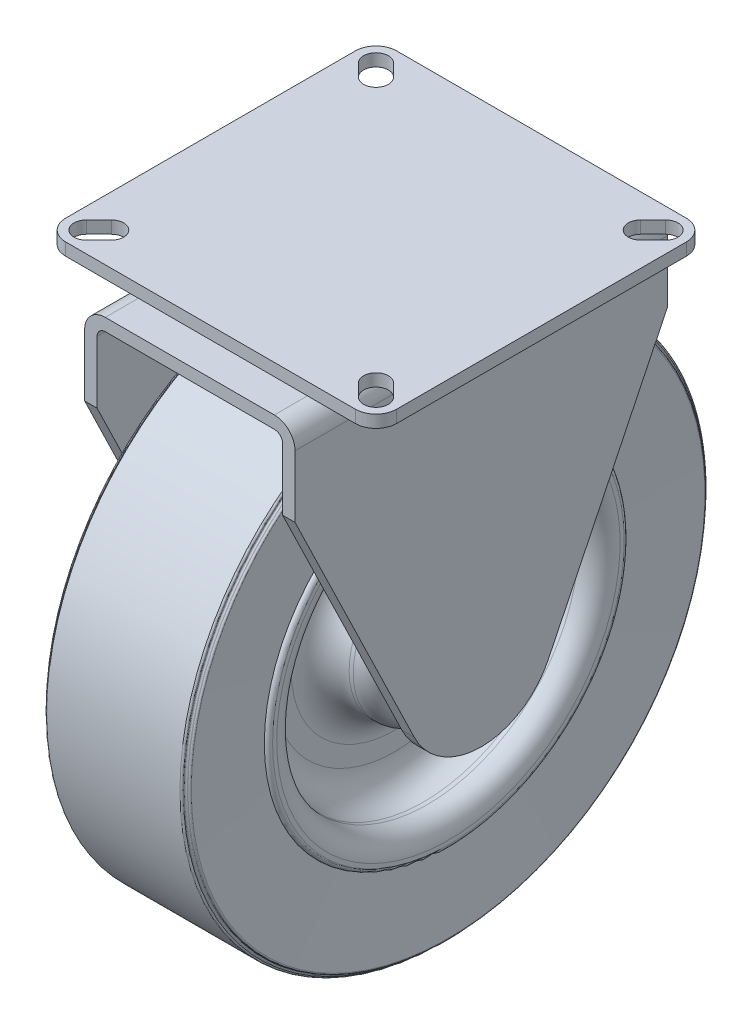
from build123d import *

# Parameters (mm, degrees)
BOSS_EXTRUDE2_START = -45
BOSS_EXTRUDE2_DEPTH = 90
CUT_EXTRUDE1_DEPTH  = 3
CUT_EXTRUDE2_START  = -47
CUT_EXTRUDE2_DEPTH  = 62.30990914
BOSS_EXTRUDE3_REACH = 110.31
SKETCH7_R           = 10
SKETCH8_R           = 20
SKETCH8_R_2         = 18
BOSS_EXTRUDE4_DEPTH = 3
BOSS_EXTRUDE5_DEPTH = 3
CUT_EXTRUDE3_DEPTH  = 3


with BuildPart() as part:
    # Sketch1 → Revolve1 (revolve)
    with BuildSketch(Plane.XY):
        with BuildLine():
            ThreePointArc((-17.5, 11), (-17.207106781, 10.292893219), (-16.5, 10))
            Line((-16.5, 10), (16.5, 10))
            ThreePointArc((16.5, 10), (17.207106781, 10.292893219), (17.5, 11))
            Line((17.5, 11), (17.5, 13))
            ThreePointArc((17.5, 13), (16.035533906, 16.535533906), (12.5, 18))
            Line((12.5, 18), (11.5, 18))
            ThreePointArc((11.5, 18), (6.550252532, 20.050252532), (4.5, 25))
            Line((4.5, 25), (4.5, 29.5))
            ThreePointArc((4.5, 29.5), (6.550252532, 34.449747468), (11.5, 36.5))
            Line((11.5, 36.5), (12.5, 36.5))
            ThreePointArc((12.5, 36.5), (16.035533906, 37.964466094), (17.5, 41.5))
            Line((17.5, 41.5), (17.5, 42.5))
            ThreePointArc((17.5, 42.5), (17.207106781, 43.207106781), (16.5, 43.5))
            Line((16.5, 43.5), (-16.5, 43.5))
            ThreePointArc((-16.5, 43.5), (-17.207106781, 43.207106781), (-17.5, 42.5))
            Line((-17.5, 42.5), (-17.5, 41.5))
            ThreePointArc((-17.5, 41.5), (-16.035533906, 37.964466094), (-12.5, 36.5))
            Line((-12.5, 36.5), (-11.5, 36.5))
            ThreePointArc((-11.5, 36.5), (-6.550252532, 34.449747468), (-4.5, 29.5))
            Line((-4.5, 29.5), (-4.5, 25))
            ThreePointArc((-4.5, 25), (-6.550252532, 20.050252532), (-11.5, 18))
            Line((-11.5, 18), (-12.5, 18))
            ThreePointArc((-12.5, 18), (-16.035533906, 16.535533906), (-17.5, 13))
            Line((-17.5, 13), (-17.5, 11))
        make_face()
    revolve(axis=Axis((-25.77893442, 0, 0), (1, 0, 0)))

    # Sketch2 → Revolve3 (revolve)
    with BuildSketch(Plane.XY):
        with BuildLine():
            Line((-17.429001248, 62.080024953), (-16.5, 43.5))
            Line((-16.5, 43.5), (16.5, 43.5))
            Line((16.5, 43.5), (17.429001248, 62.080024953))
            ThreePointArc((17.429001248, 62.080024953), (17.319319237, 62.375690026), (17.029500312, 62.5))
            Line((17.029500312, 62.5), (16.9, 62.5))
            ThreePointArc((16.9, 62.5), (16.617157288, 62.617157288), (16.5, 62.9))
            Line((16.5, 62.9), (16.5, 63.1))
            ThreePointArc((16.5, 63.1), (16.382842712, 63.382842712), (16.1, 63.5))
            Line((16.1, 63.5), (-16.1, 63.5))
            ThreePointArc((-16.1, 63.5), (-16.382842712, 63.382842712), (-16.5, 63.1))
            Line((-16.5, 63.1), (-16.5, 62.9))
            ThreePointArc((-16.5, 62.9), (-16.617157288, 62.617157288), (-16.9, 62.5))
            Line((-16.9, 62.5), (-17.029500312, 62.5))
            ThreePointArc((-17.029500312, 62.5), (-17.319319237, 62.375690026), (-17.429001248, 62.080024953))
        make_face()
    revolve(axis=Axis((-24.991695295, 0, 0), (1, 0, 0)))


with BuildPart() as body_2:
    # Sketch5 → Boss-Extrude2 (new body)
    with BuildSketch(Plane.XY.offset(BOSS_EXTRUDE2_START)):
        with BuildLine():
            Line((22.429001248, -18), (25.429001248, -18))
            Line((25.429001248, -18), (25.429001248, 66.5))
            ThreePointArc((25.429001248, 66.5), (23.964535154, 70.035533906), (20.429001248, 71.5))
            Line((20.429001248, 71.5), (-20.429001248, 71.5))
            ThreePointArc((-20.429001248, 71.5), (-23.964535154, 70.035533906), (-25.429001248, 66.5))
            Line((-25.429001248, 66.5), (-25.429001248, -18))
            Line((-25.429001248, -18), (-22.429001248, -18))
            Line((-22.429001248, -18), (-22.429001248, -15))
            Line((-22.429001248, -15), (-22.429001248, 66.5))
            ThreePointArc((-22.429001248, 66.5), (-21.84321481, 67.914213562), (-20.429001248, 68.5))
            Line((-20.429001248, 68.5), (20.429001248, 68.5))
            ThreePointArc((20.429001248, 68.5), (21.84321481, 67.914213562), (22.429001248, 66.5))
            Line((22.429001248, 66.5), (22.429001248, -15))
            Line((22.429001248, -15), (22.429001248, -18))
        make_face()
    extrude(amount=BOSS_EXTRUDE2_DEPTH)

    # Sketch6 → Cut-Extrude1 (cut)
    with BuildSketch(Plane.ZY.offset(25.429001248)):
        with BuildLine():
            ThreePointArc((16.193849901, -7.858703797), (9.553620523, -15.255436241), (-8.9e-08, -18))
            Line((-8.9e-08, -18), (45, -18))
            Line((45, -18), (45, 51.5))
            Line((45, 51.5), (16.193849901, -7.858703797))
        make_face()
        with BuildLine():
            Line((-16.193849901, -7.858703797), (-45, 51.5))
            Line((-45, 51.5), (-45, -18))
            Line((-45, -18), (-8.9e-08, -18))
            ThreePointArc((-8.9e-08, -18), (-9.553620599, -15.255436194), (-16.193849901, -7.858703797))
        make_face()
    extrude(amount=-CUT_EXTRUDE1_DEPTH, mode=Mode.SUBTRACT)

    # Sketch6<3> → Cut-Extrude2 (cut, through all)
    with BuildSketch(Plane.ZY.offset(25.429001248).offset(CUT_EXTRUDE2_START)):
        with BuildLine():
            ThreePointArc((16.193849901, -7.858703797), (9.553620523, -15.255436241), (-8.9e-08, -18))
            Line((-8.9e-08, -18), (45, -18))
            Line((45, -18), (45, 51.5))
            Line((45, 51.5), (16.193849901, -7.858703797))
        make_face()
        with BuildLine():
            Line((-16.193849901, -7.858703797), (-45, 51.5))
            Line((-45, 51.5), (-45, -18))
            Line((-45, -18), (-8.9e-08, -18))
            ThreePointArc((-8.9e-08, -18), (-9.553620599, -15.255436194), (-16.193849901, -7.858703797))
        make_face()
    extrude(amount=-CUT_EXTRUDE2_DEPTH, mode=Mode.SUBTRACT)

    # Sketch7 → Boss-Extrude3 (add, up to next)
    with BuildSketch(Plane.ZY.offset(25.429001248), mode=Mode.PRIVATE) as boss_extrude3_sk1:
        Circle(SKETCH7_R)
    boss_extrude3_tool1 = extrude(boss_extrude3_sk1.sketch, amount=-BOSS_EXTRUDE3_REACH, mode=Mode.PRIVATE) - body_2.part

    add(part.part)  # Boss-Extrude3 merges part
    add(boss_extrude3_tool1.solids().sort_by_distance((-25.429001, 0, 0))[0])

    # Sketch8 → Boss-Extrude4 (add)
    with BuildSketch(Plane(origin=(0, 71.5, 0), x_dir=(1, 0, 0), z_dir=(0, 1, 0))):
        Circle(SKETCH8_R)
        Circle(SKETCH8_R_2, mode=Mode.SUBTRACT)
    extrude(amount=BOSS_EXTRUDE4_DEPTH)

    # Sketch9 → Boss-Extrude5 (add)
    with BuildSketch(Plane(origin=(0, 74.5, 0), x_dir=(1, 0, 0), z_dir=(0, 1, 0))):
        with BuildLine():
            Line((-35, 40), (35, 40))
            ThreePointArc((35, 40), (38.535533906, 38.535533906), (40, 35))
            Line((40, 35), (40, -35))
            ThreePointArc((40, -35), (38.535533906, -38.535533906), (35, -40))
            Line((35, -40), (-35, -40))
            ThreePointArc((-35, -40), (-38.535533906, -38.535533906), (-40, -35))
            Line((-40, -35), (-40, 35))
            ThreePointArc((-40, 35), (-38.535533906, 38.535533906), (-35, 40))
        make_face()
    extrude(amount=BOSS_EXTRUDE5_DEPTH)

    # Sketch10 → Cut-Extrude3 (cut)
    with BuildSketch(Plane(origin=(0, 77.5, 0), x_dir=(1, 0, 0), z_dir=(0, 1, 0))):
        with BuildLine():
            Line((-37.121320344, 32.878679656), (-34.121320344, 29.878679656))
            ThreePointArc((-34.121320344, 29.878679656), (-29.878679656, 29.878679656), (-29.878679656, 34.121320344))
            Line((-29.878679656, 34.121320344), (-32.878679656, 37.121320344))
            ThreePointArc((-32.878679656, 37.121320344), (-37.121320344, 37.121320344), (-37.121320344, 32.878679656))
        make_face()
        with BuildLine():
            Line((29.878679656, 34.121320344), (32.878679656, 37.121320344))
            ThreePointArc((32.878679656, 37.121320344), (37.121320344, 37.121320344), (37.121320344, 32.878679656))
            Line((37.121320344, 32.878679656), (34.121320344, 29.878679656))
            ThreePointArc((34.121320344, 29.878679656), (29.878679656, 29.878679656), (29.878679656, 34.121320344))
        make_face()
        with BuildLine():
            Line((37.121320344, -32.878679656), (34.121320344, -29.878679656))
            ThreePointArc((34.121320344, -29.878679656), (29.878679656, -29.878679656), (29.878679656, -34.121320344))
            Line((29.878679656, -34.121320344), (32.878679656, -37.121320344))
            ThreePointArc((32.878679656, -37.121320344), (37.121320344, -37.121320344), (37.121320344, -32.878679656))
        make_face()
        with BuildLine():
            Line((-29.878679656, -34.121320344), (-32.878679656, -37.121320344))
            ThreePointArc((-32.878679656, -37.121320344), (-37.121320344, -37.121320344), (-37.121320344, -32.878679656))
            Line((-37.121320344, -32.878679656), (-34.121320344, -29.878679656))
            ThreePointArc((-34.121320344, -29.878679656), (-29.878679656, -29.878679656), (-29.878679656, -34.121320344))
        make_face()
    extrude(amount=-CUT_EXTRUDE3_DEPTH, mode=Mode.SUBTRACT)


solid = body_2.part
